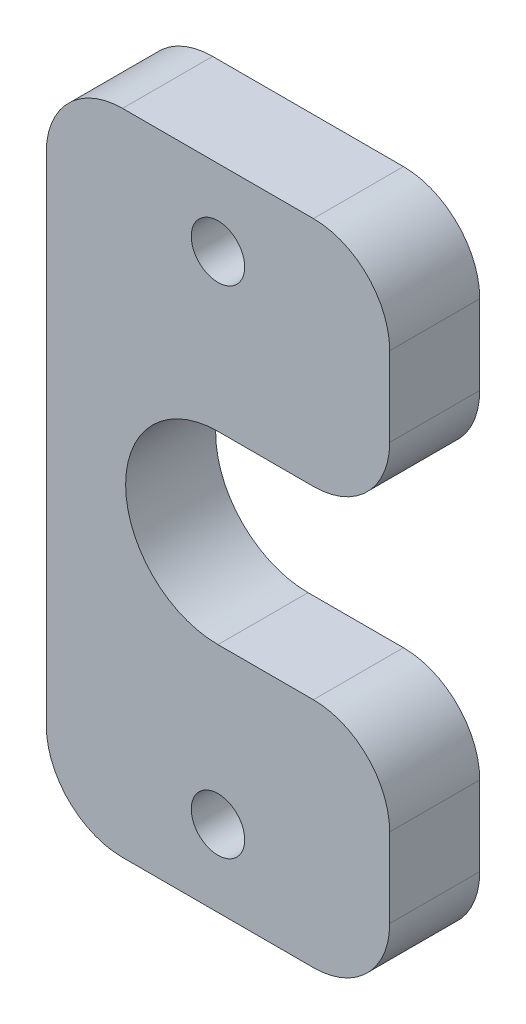
from build123d import *

# Parameters (mm, degrees)
SKETCH_1_R          = 1.75
EXTRUDE_1_DEPTH     = 5.9
CUT_EXTRUDE_1_DEPTH = 2.5


with BuildPart() as part:
    # 草图1 → 凸台-拉伸1 (new body)
    with BuildSketch(Plane.XY):
        with BuildLine():
            Line((-11.25, 16.25), (-11.25, -16.25))
            ThreePointArc((-11.25, -16.25), (-9.785533906, -19.785533906), (-6.25, -21.25))
            Line((-6.25, -21.25), (6.25, -21.25))
            ThreePointArc((6.25, -21.25), (9.785533906, -19.785533906), (11.25, -16.25))
            Line((11.25, -16.25), (11.25, -11.05))
            ThreePointArc((11.25, -11.05), (9.785533906, -7.514466094), (6.25, -6.05))
            Line((6.25, -6.05), (0, -6.05))
            ThreePointArc((0, -6.05), (-6.05, 0), (0, 6.05))
            Line((0, 6.05), (6.25, 6.05))
            ThreePointArc((6.25, 6.05), (9.785533906, 7.514466094), (11.25, 11.05))
            Line((11.25, 11.05), (11.25, 16.25))
            ThreePointArc((11.25, 16.25), (9.785533906, 19.785533906), (6.25, 21.25))
            Line((6.25, 21.25), (-6.25, 21.25))
            ThreePointArc((-6.25, 21.25), (-9.785533906, 19.785533906), (-11.25, 16.25))
        make_face()
        with Locations((0, 16.25)):
            Circle(SKETCH_1_R, mode=Mode.SUBTRACT)
        with Locations((0, -16.25)):
            Circle(SKETCH_1_R, mode=Mode.SUBTRACT)
    extrude(amount=EXTRUDE_1_DEPTH)

    # 草图2 → 切除-拉伸1 (cut)
    with BuildSketch(Plane(origin=(0, 0, 0), x_dir=(-1, 0, 0), z_dir=(0, 0, -1))):
        Polygon((1.645448267, 13.4), (3.290896534, 16.25), (1.645448267, 19.1), (-1.645448267, 19.1), (-3.290896534, 16.25), (-1.645448267, 13.4), align=None)
        Polygon((-1.645448267, -13.4), (-3.290896534, -16.25), (-1.645448267, -19.1), (1.645448267, -19.1), (3.290896534, -16.25), (1.645448267, -13.4), align=None)
    extrude(amount=-CUT_EXTRUDE_1_DEPTH, mode=Mode.SUBTRACT)


solid = part.part
